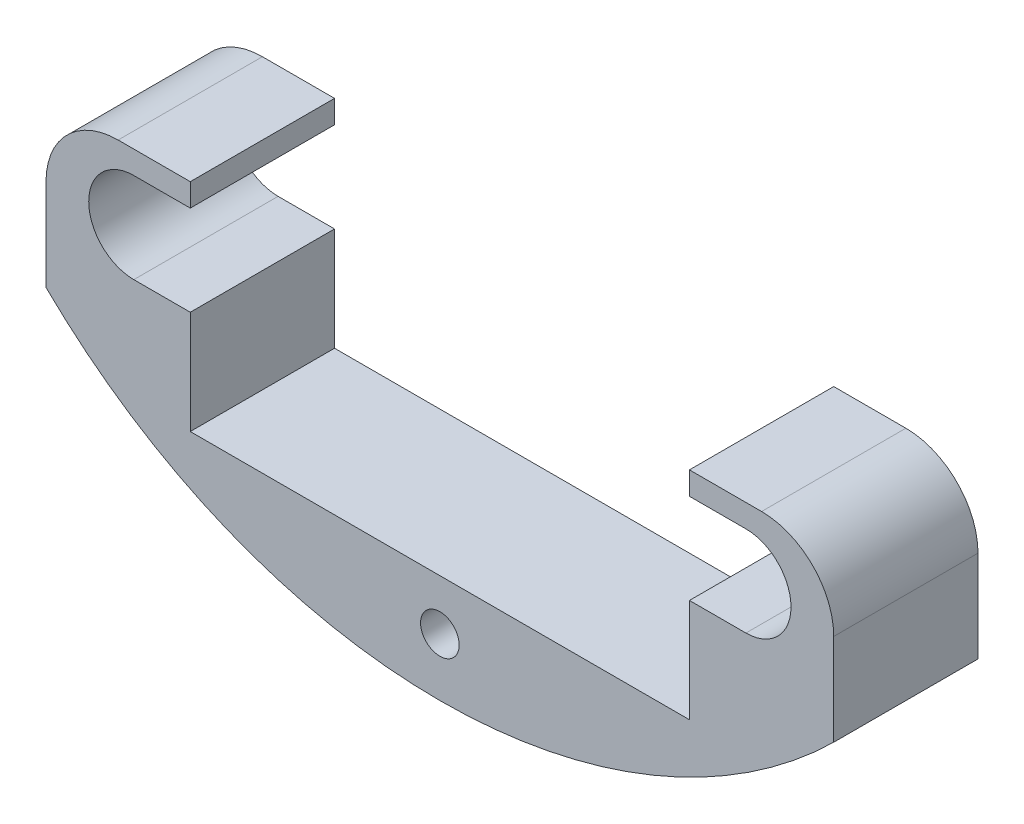
from build123d import *

# Parameters (mm, degrees)
BOSS_EXTRUDE1_DEPTH  = 12.7
FILLET1_R            = 6.35
M3_CLEARANCE_HOLE1_D = 3.4


with BuildPart() as part:
    # Sketch2 → Boss-Extrude1 (new body)
    with BuildSketch(Plane.XY):
        with BuildLine():
            Line((-34.671, -20.955), (-34.671, -35.371495007))
            ThreePointArc((-34.671, -35.371495007), (-18.725260376, -45.85395865), (0, -49.53))
            Line((0, -49.53), (0, -40.005))
            Line((0, -40.005), (-21.971, -40.005))
            Line((-21.971, -40.005), (-21.971, -30.909518363))
            Line((-21.971, -30.909518363), (-26.940768363, -30.909518363))
            ThreePointArc((-26.940768363, -30.909518363), (-30.909518363, -26.940768363), (-26.940768363, -22.972018363))
            Line((-26.940768363, -22.972018363), (-21.971, -22.972018363))
            Line((-21.971, -22.972018363), (-21.971, -20.955))
            Line((-21.971, -20.955), (-34.671, -20.955))
        make_face()
    boss_extrude1 = extrude(amount=BOSS_EXTRUDE1_DEPTH)

    # Mirror1: Boss-Extrude1 across plane
    add(boss_extrude1.mirror(Plane(origin=(0, -40.005, 12.7), x_dir=(0, 0, 1), z_dir=(-1, 0, 0))))

    # Fillet1
    fillet1_edges = [part.edges().sort_by_distance(p)[0] for p in [
        (-34.671, -20.955, 6.35),
        (34.671, -20.955, 6.35),
    ]]
    fillet(fillet1_edges, radius=FILLET1_R)

    # M3 Clearance Hole1 (through all)
    with Locations(Plane.XY.offset(12.7)):
        with Locations((0, -44.45)):
            Hole(M3_CLEARANCE_HOLE1_D / 2)


solid = part.part
